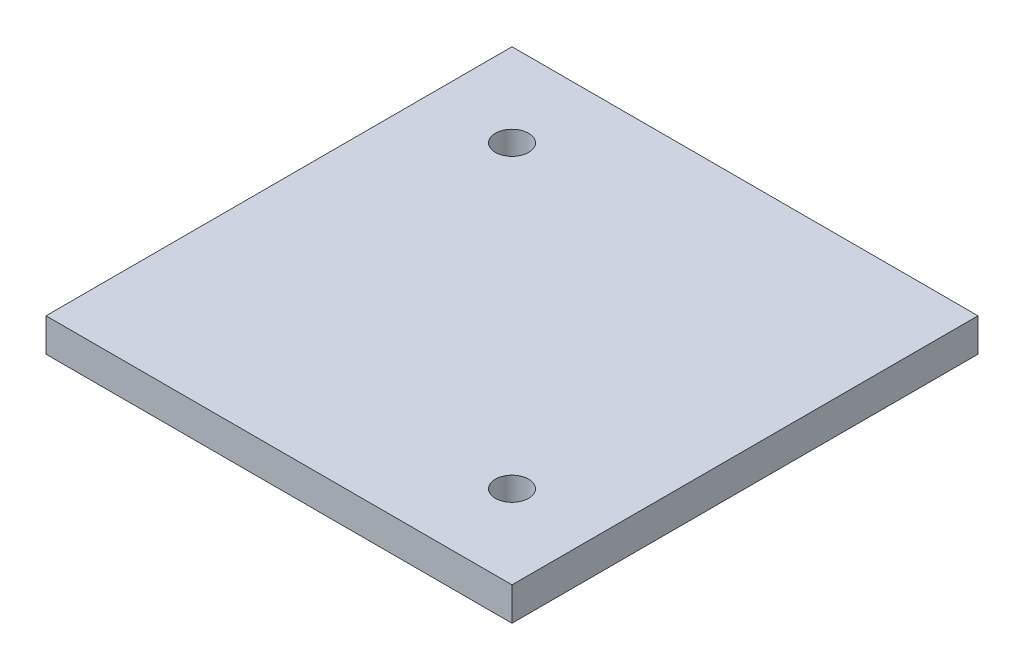
from build123d import *

# Parameters (mm, degrees)
SKETCH1_W           = 44.45
SKETCH1_H           = 44.45
SKETCH1_R           = 1.5875
BOSS_EXTRUDE1_DEPTH = 3.175


with BuildPart() as part:
    # Sketch1 → Boss-Extrude1 (new body)
    with BuildSketch(Plane(origin=(0, 0, 0), x_dir=(1, 0, 0), z_dir=(0, 1, 0))):
        with Locations((22.225, 22.225)):
            Rectangle(SKETCH1_W, SKETCH1_H)
        with Locations(Location((7.9375, 36.5125, 0), (0, 0, 270))):
            Circle(SKETCH1_R, mode=Mode.SUBTRACT)
        with Locations(Location((36.5125, 7.9375, 0), (0, 0, 270))):
            Circle(SKETCH1_R, mode=Mode.SUBTRACT)
    extrude(amount=BOSS_EXTRUDE1_DEPTH)


solid = part.part
